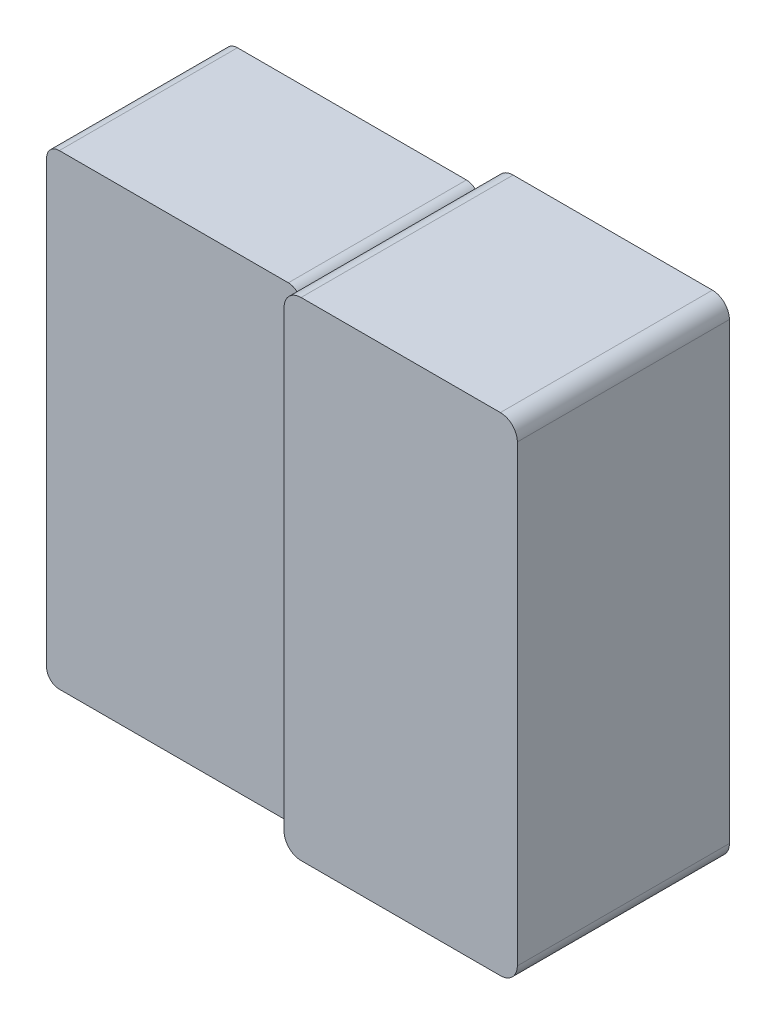
from build123d import *

# Parameters (mm, degrees)
HEADER_BUDGET_5P5X11P5_H5_MINUSX_DEPTH = 5
MATED_PLUG_BUDGET_OUTWARD_MINUSX_DEPTH = 4.2


with BuildPart() as part:
    # 草图1 → Header_budget_5p5x11p5_H5_minusX (new body)
    with BuildSketch(Plane.XY):
        with BuildLine():
            Line((-9.6, -5.75), (-4.9, -5.75))
            ThreePointArc((-4.9, -5.75), (-4.617157288, -5.632842712), (-4.5, -5.35))
            Line((-4.5, -5.35), (-4.5, 5.35))
            ThreePointArc((-4.5, 5.35), (-4.617157288, 5.632842712), (-4.9, 5.75))
            Line((-4.9, 5.75), (-9.6, 5.75))
            ThreePointArc((-9.6, 5.75), (-9.882842712, 5.632842712), (-10, 5.35))
            Line((-10, 5.35), (-10, -5.35))
            ThreePointArc((-10, -5.35), (-9.882842712, -5.632842712), (-9.6, -5.75))
        make_face()
    extrude(amount=HEADER_BUDGET_5P5X11P5_H5_MINUSX_DEPTH)

    # 草图2 → Mated_plug_budget_outward_minusX (add)
    with BuildSketch(Plane.XY.offset(0.4)):
        with BuildLine():
            Line((-15.7, -5.5), (-10.3, -5.5))
            ThreePointArc((-10.3, -5.5), (-10.087867966, -5.412132034), (-10, -5.2))
            Line((-10, -5.2), (-10, 5.2))
            ThreePointArc((-10, 5.2), (-10.087867966, 5.412132034), (-10.3, 5.5))
            Line((-10.3, 5.5), (-15.7, 5.5))
            ThreePointArc((-15.7, 5.5), (-15.912132034, 5.412132034), (-16, 5.2))
            Line((-16, 5.2), (-16, -5.2))
            ThreePointArc((-16, -5.2), (-15.912132034, -5.412132034), (-15.7, -5.5))
        make_face()
    extrude(amount=MATED_PLUG_BUDGET_OUTWARD_MINUSX_DEPTH)


solid = part.part
